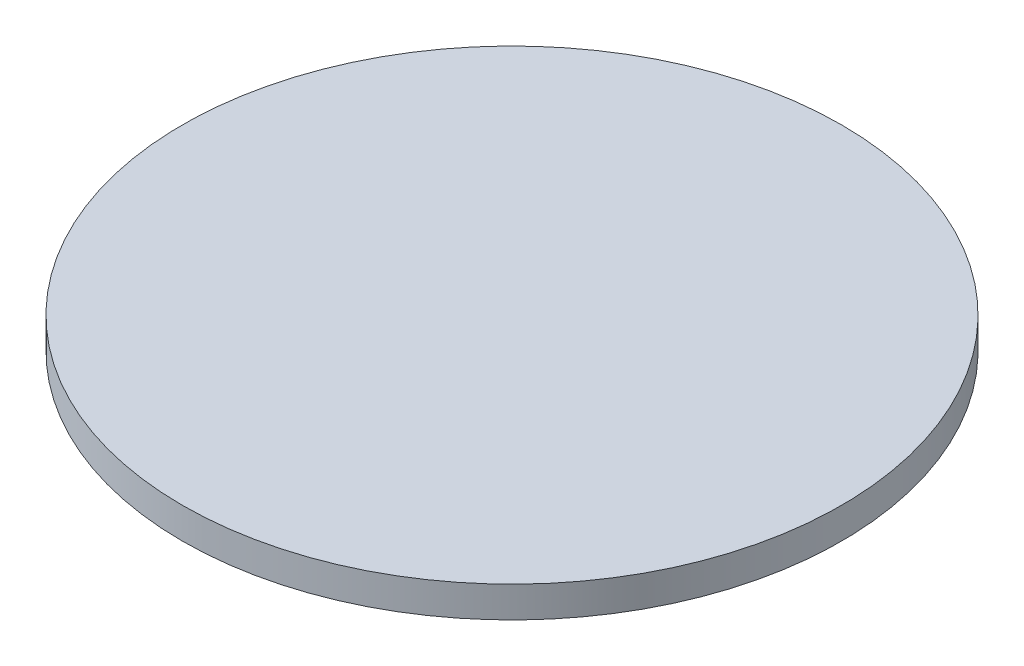
from build123d import *

# Parameters (mm, degrees)
SKETCH_1_R      = 42.5
EXTRUDE_1_DEPTH = 4


with BuildPart() as part:
    # Эскиз1 → Вытянуть1 (new body)
    with BuildSketch(Plane(origin=(0, 0, 0), x_dir=(1, 0, 0), z_dir=(0, 1, 0))):
        with Locations(Location((0, 0, 0), (0, 0, 270))):
            Circle(SKETCH_1_R)
    extrude(amount=EXTRUDE_1_DEPTH)


solid = part.part
